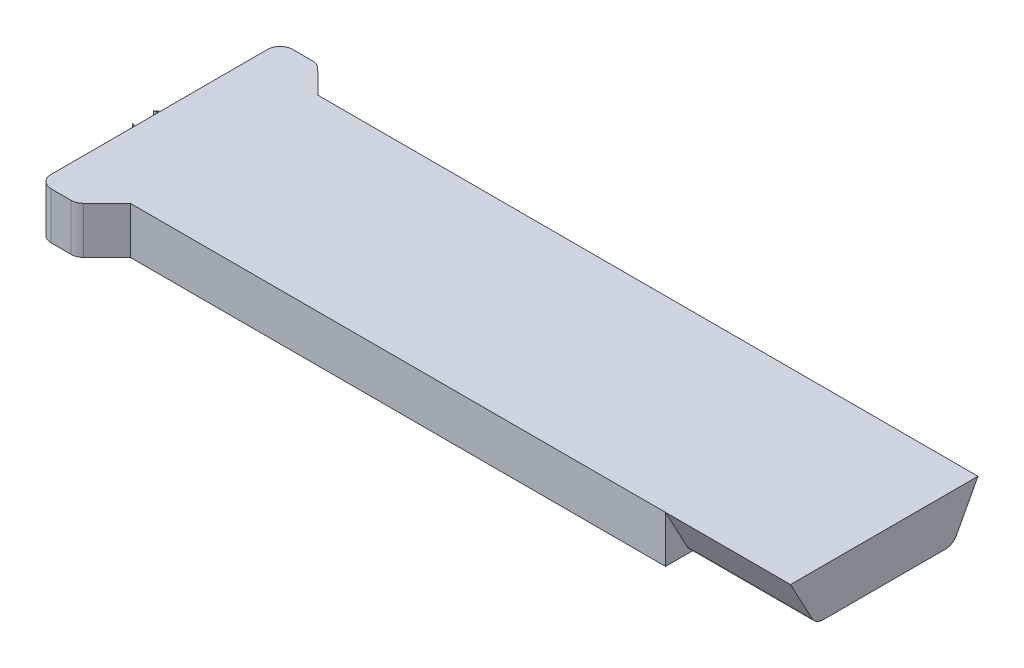
from build123d import *

# Parameters (mm, degrees)
BOSS_EXTRUDE1_DEPTH = 190.5
SKETCH3_W           = 981.481353614
SKETCH3_H           = 190.5
BOSS_EXTRUDE2_DEPTH = 152.4
FILLET2_R           = 50.8
CUT_EXTRUDE1_DEPTH  = 508
FILLET3_R           = 50.8
BOSS_EXTRUDE3_DEPTH = 139.7
BOSS_EXTRUDE4_START = -139.7
BOSS_EXTRUDE4_DEPTH = 139.7
SKETCH8_R           = 15.24
CUT_EXTRUDE2_DEPTH  = 12.7
SKETCH10_W          = 101.6
SKETCH10_H          = 139.7
CUT_EXTRUDE4_DEPTH  = 7.112
SKETCH9_R           = 8.89
CUT_EXTRUDE5_DEPTH  = 179.07
FILLET4_R           = 25.4


with BuildPart() as part:
    # Sketch1 → Boss-Extrude1 (new body)
    with BuildSketch(Plane(origin=(0, 0, 0), x_dir=(1, 0, 0), z_dir=(0, 1, 0))):
        Polygon((-1284.876827817, -381), (1397, -381), (1397, 381), (-1284.876827817, 381), (-1397, 490.740676807), (-1397, -490.740676807), align=None)
    extrude(amount=BOSS_EXTRUDE1_DEPTH)

    # Sketch3 → Boss-Extrude2 (add)
    with BuildSketch(Plane.ZY.offset(1397)):
        with Locations((0, 95.25)):
            Rectangle(SKETCH3_W, SKETCH3_H)
    extrude(amount=BOSS_EXTRUDE2_DEPTH)

    # Fillet2
    fillet2_edges = [part.edges().sort_by_distance(p)[0] for p in [
        (-1397, 95.25, 490.740676807),
        (-1397, 95.25, -490.740676807),
        (-1549.4, 95.25, -490.740676807),
        (-1549.4, 95.25, 490.740676807),
    ]]
    fillet(fillet2_edges, radius=FILLET2_R)

    # Sketch4 → Cut-Extrude1 (cut)
    with BuildSketch(Plane(origin=(1397, 0, 0), x_dir=(0, 0, -1), z_dir=(1, 0, 0))):
        Polygon((-381, 190.5), (-279.4, 0), (-381, 0), align=None)
        Polygon((381, 190.5), (279.4, 0), (381, 0), align=None)
    extrude(amount=-CUT_EXTRUDE1_DEPTH, mode=Mode.SUBTRACT)

    # Fillet3
    fillet3_edges = [part.edges().sort_by_distance(p)[0] for p in [
        (1143, 0, 279.4),
        (1143, 0, -279.4),
    ]]
    fillet(fillet3_edges, radius=FILLET3_R)

    # Sketch6 → Boss-Extrude3 (add)
    with BuildSketch(Plane.XZ):
        Polygon((-1562.1, 50.8), (-1562.1, -50.8), (-1587.5, -50.8), (-1587.5, -63.5), (-1549.4, -63.5), (-1549.4, 63.5), (-1587.5, 63.5), (-1587.5, 50.8), align=None)
    extrude(amount=-BOSS_EXTRUDE3_DEPTH)

    # Sketch7 → Boss-Extrude4 (add)
    with BuildSketch(Plane(origin=(0, 139.7, 0), x_dir=(1, 0, 0), z_dir=(0, 1, 0)).offset(BOSS_EXTRUDE4_START)):
        Polygon((-1587.5, 63.5), (-1615.936596207, 43.180437011), (-1587.5, 50.8), align=None)
        Polygon((-1615.936596207, -43.180437011), (-1587.5, -50.8), (-1587.5, -63.5), align=None)
    extrude(amount=BOSS_EXTRUDE4_DEPTH)

    # Sketch8 → Cut-Extrude2 (cut)
    with BuildSketch(Plane.ZY.offset(1562.1)):
        with Locations((0, 106.68)):
            Circle(SKETCH8_R)
        with Locations((0, 33.02)):
            Circle(SKETCH8_R)
    extrude(amount=-CUT_EXTRUDE2_DEPTH, mode=Mode.SUBTRACT)

    # Sketch10 → Cut-Extrude4 (cut)
    with BuildSketch(Plane.ZY.offset(1562.1)):
        with Locations((0, 69.85)):
            Rectangle(SKETCH10_W, SKETCH10_H)
    extrude(amount=-CUT_EXTRUDE4_DEPTH, mode=Mode.SUBTRACT)

    # Sketch9 → Cut-Extrude5 (cut)
    with BuildSketch(Plane(origin=(0, 0, -63.5), x_dir=(-1, 0, 0), z_dir=(0, 0, -1))):
        with Locations((1568.45, 106.68)):
            Circle(SKETCH9_R)
        with Locations((1568.45, 33.02)):
            Circle(SKETCH9_R)
    extrude(amount=-CUT_EXTRUDE5_DEPTH, mode=Mode.SUBTRACT)

    # Fillet4
    fillet4_edges = [part.edges().sort_by_distance(p)[0] for p in [
        (-1587.5, 69.85, -63.5),
        (-1587.5, 69.85, 63.5),
    ]]
    fillet(fillet4_edges, radius=FILLET4_R)


solid = part.part
